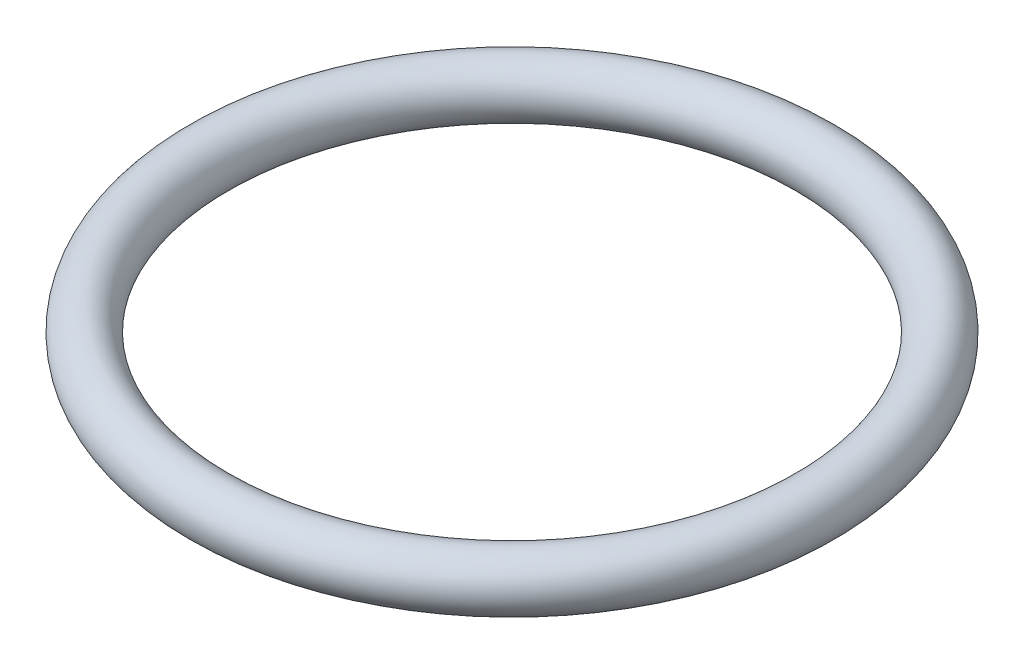
from build123d import *

# Parameters (mm, degrees)
SKETCH1_R = 1.25


with BuildPart() as part:
    # Sketch1 → Revolve1 (revolve)
    with BuildSketch(Plane.XY, mode=Mode.PRIVATE) as revolve1_sk:
        with Locations((-13.97, 0)):
            Circle(SKETCH1_R)
    revolve(revolve1_sk.sketch.rotate(Axis((0, 0, 0), (0, 1, 0)), 270), axis=Axis((0, 0, 0), (0, 1, 0)))


solid = part.part
